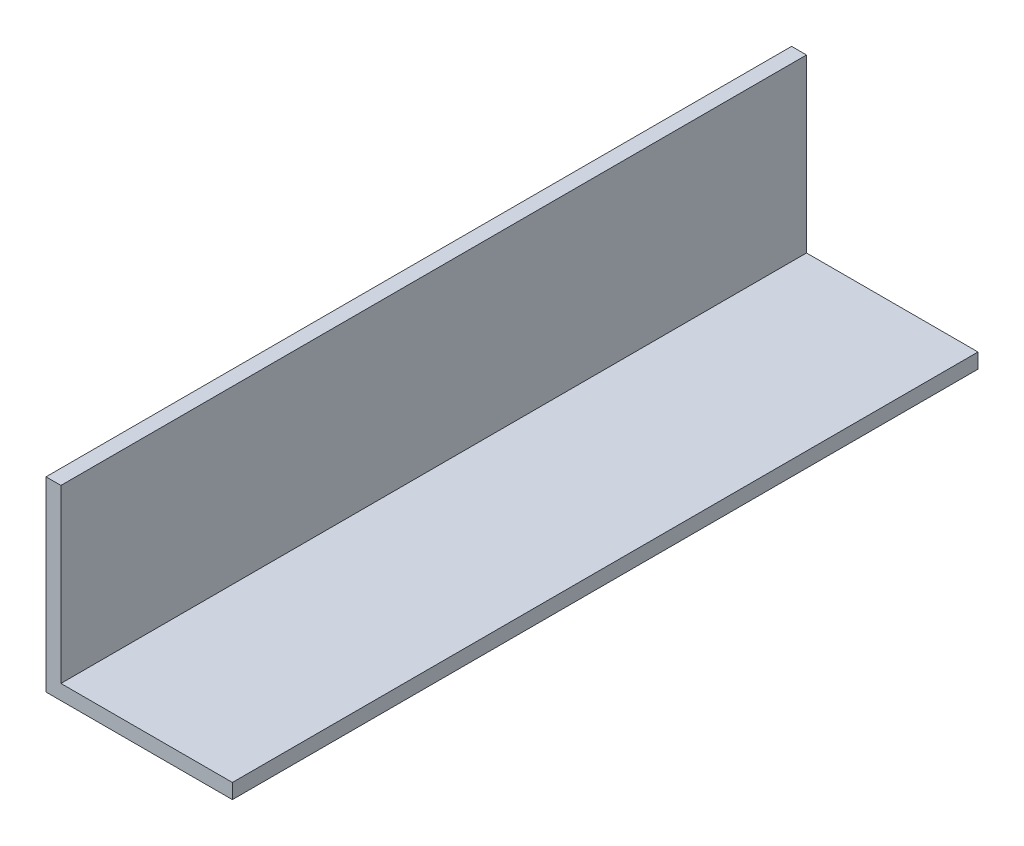
from build123d import *

# Parameters (mm, degrees)
BOSS_EXTRUDE1_DEPTH = 100


with BuildPart() as part:
    # Sketch1 → Boss-Extrude1 (new body)
    with BuildSketch(Plane.XY):
        Polygon((0, 0), (25, 0), (25, 2), (2, 2), (2, 25), (0, 25), align=None)
    extrude(amount=BOSS_EXTRUDE1_DEPTH)


solid = part.part
